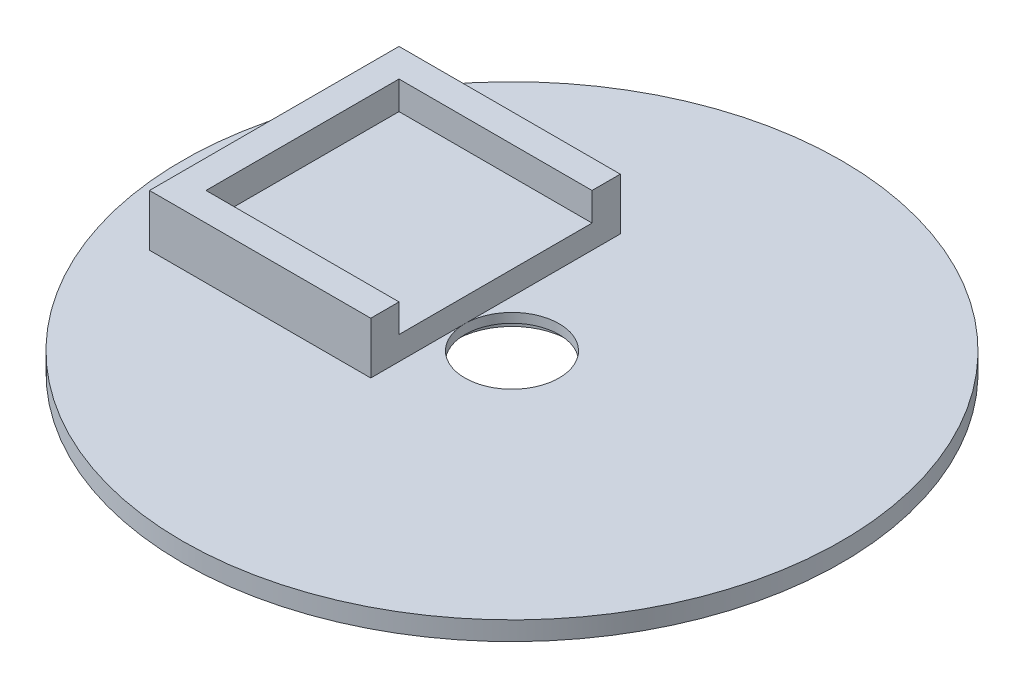
from build123d import *

# Parameters (mm, degrees)
SKETCH1_R               = 35
BOSS_EXTRUDE1_DEPTH     = 2
SKETCH3_R               = 6
CUT_EXTRUDE2_DEPTH      = 1
BOSS_EXTRUDE2_DEPTH     = 7.5
CUT_EXTRUDE3_DEPTH      = 50.922439844
CUT_EXTRUDE3_DEPTH_BACK = 50.922439844
SKETCH5_R               = 5
SKETCH6_W               = 23.5
SKETCH6_H               = 26.5
BOSS_EXTRUDE3_DEPTH     = 2.5


with BuildPart() as part:
    # Sketch1 → Boss-Extrude1 (new body)
    with BuildSketch(Plane(origin=(0, 0, 0), x_dir=(1, 0, 0), z_dir=(0, 1, 0))):
        with Locations(Location((0, 0, 0), (0, 0, 270))):
            Circle(SKETCH1_R)
    extrude(amount=BOSS_EXTRUDE1_DEPTH)

    # Sketch3 → Cut-Extrude2 (cut)
    with BuildSketch(Plane(origin=(0, 0, 0), x_dir=(1, 0, 0), z_dir=(0, 1, 0))):
        with Locations(Location((0, 0, 0), (0, 0, 270))):
            Circle(SKETCH3_R)
    extrude(amount=CUT_EXTRUDE2_DEPTH, mode=Mode.SUBTRACT)

    # Sketch4 → Boss-Extrude2 (add)
    with BuildSketch(Plane(origin=(0, 0, 0), x_dir=(1, 0, 0), z_dir=(0, 1, 0))):
        Polygon((-5, 13.5), (-5, 16.5), (-28.5, 16.5), (-28.5, -10), (-5, -10), (-5, -7), (-25.5, -7), (-25.5, 13.5), align=None)
    extrude(amount=BOSS_EXTRUDE2_DEPTH)

    # Sketch5 → Cut-Extrude3 (cut, two sides: drawn at the far end of the back side and taken through both)
    with BuildSketch(Plane.XZ.offset(-1).offset(-CUT_EXTRUDE3_DEPTH_BACK)):
        with Locations(Location((0, 0, 0), (0, 0, 270))):
            Circle(SKETCH5_R)
    extrude(amount=CUT_EXTRUDE3_DEPTH + CUT_EXTRUDE3_DEPTH_BACK, mode=Mode.SUBTRACT)

    # Sketch6 → Boss-Extrude3 (add)
    with BuildSketch(Plane(origin=(0, 2, 0), x_dir=(1, 0, 0), z_dir=(0, 1, 0))):
        with Locations((-16.75, 3.25)):
            Rectangle(SKETCH6_W, SKETCH6_H)
    extrude(amount=BOSS_EXTRUDE3_DEPTH)


solid = part.part
